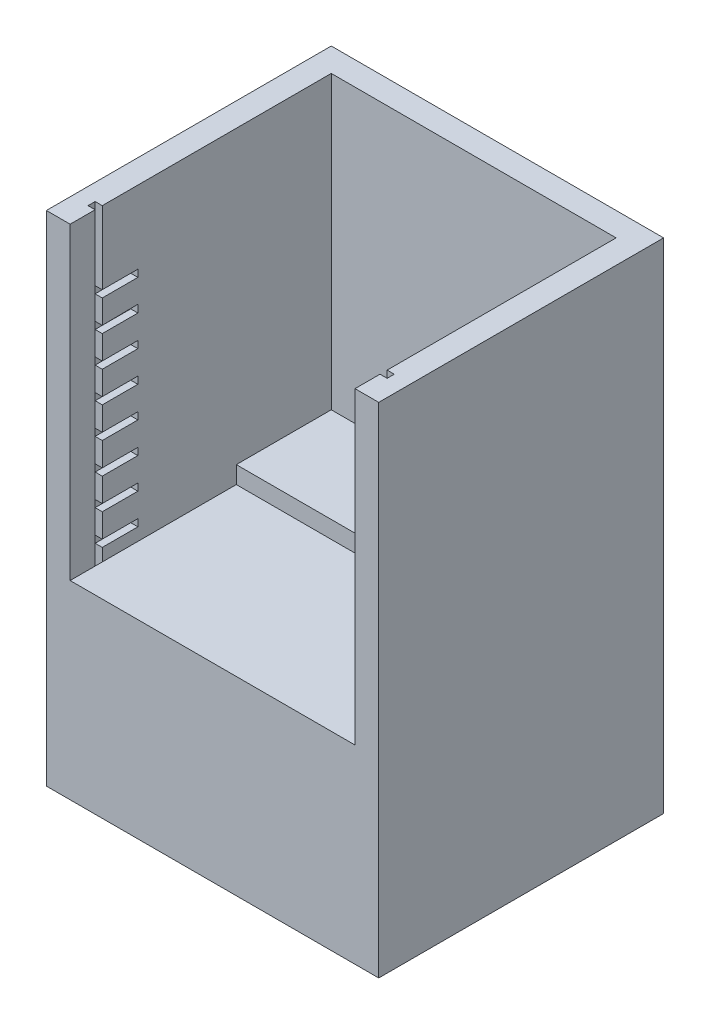
from build123d import *

# Parameters (mm, degrees)
SKETCH1_W           = 140
SKETCH1_H           = 120
BOSS_EXTRUDE1_DEPTH = 10
BOSS_EXTRUDE2_DEPTH = 200
SKETCH3_W           = 15
SKETCH3_H           = 3
CUT_EXTRUDE1_DEPTH  = 3
SKETCH4_W           = 15
SKETCH4_H           = 3
CUT_EXTRUDE2_DEPTH  = 3
SKETCH5_W           = 120
SKETCH5_H           = 7.283967232
BOSS_EXTRUDE3_DEPTH = 40
SKETCH6_W           = 120
SKETCH6_H           = 70
BOSS_EXTRUDE4_DEPTH = 79


with BuildPart() as part:
    # Sketch1 → Boss-Extrude1 (new body)
    with BuildSketch(Plane(origin=(0, 0, 0), x_dir=(1, 0, 0), z_dir=(0, 1, 0))):
        with Locations((70, 60)):
            Rectangle(SKETCH1_W, SKETCH1_H)
    extrude(amount=BOSS_EXTRUDE1_DEPTH)

    # Sketch2 → Boss-Extrude2 (add)
    with BuildSketch(Plane(origin=(0, 10, 0), x_dir=(1, 0, 0), z_dir=(0, 1, 0))):
        Polygon((0, 120), (0, 0), (10, 0), (10, 10.536291888), (7, 10.536291888), (7, 13.536291888), (10, 13.536291888), (10, 110), (70, 110), (70, 120), align=None)
        Polygon((130, 10.536291888), (130, 0), (140, 0), (140, 120), (70, 120), (70, 110), (130, 110), (130, 13.536291888), (133, 13.536291888), (133, 10.536291888), align=None)
    extrude(amount=BOSS_EXTRUDE2_DEPTH)

    # Sketch3 → Cut-Extrude1 (cut)
    with BuildSketch(Plane(origin=(10, 0, 0), x_dir=(0, 0, -1), z_dir=(1, 0, 0))):
        with Locations((21.036291888, 177.819120876)):
            Rectangle(SKETCH3_W, SKETCH3_H)
        Polygon((13.536291888, 166.319120876), (13.536291888, 163.319120876), (28.536291888, 163.319120876), (28.536291888, 166.527780645), align=None)
        with Locations((21.036291888, 151.819120876)):
            Rectangle(SKETCH3_W, SKETCH3_H)
        with Locations((21.036291888, 138.819120876)):
            Rectangle(SKETCH3_W, SKETCH3_H)
        with Locations((21.036291888, 125.819120876)):
            Rectangle(SKETCH3_W, SKETCH3_H)
        with Locations((21.036291888, 112.819120876)):
            Rectangle(SKETCH3_W, SKETCH3_H)
        with Locations((21.036291888, 99.819120876)):
            Rectangle(SKETCH3_W, SKETCH3_H)
        with Locations((21.036291888, 86.819120876)):
            Rectangle(SKETCH3_W, SKETCH3_H)
        Polygon((13.536291888, 75), (13.536291888, 72), (28.533994657, 71.737489743), (28.533994657, 75), align=None)
        with Locations((21.036291888, 60.5)):
            Rectangle(SKETCH3_W, SKETCH3_H)
        Polygon((13.536291888, 49), (13.536291888, 46), (28.536291888, 46), (28.536291888, 49), (13.757115753, 49), align=None)
        with Locations((21.036291888, 34.5)):
            Rectangle(SKETCH3_W, SKETCH3_H)
        with Locations((21.036291888, 21.5)):
            Rectangle(SKETCH3_W, SKETCH3_H)
    extrude(amount=-CUT_EXTRUDE1_DEPTH, mode=Mode.SUBTRACT)

    # Sketch4 → Cut-Extrude2 (cut)
    with BuildSketch(Plane.ZY.offset(-130)):
        with Locations((-21.036291888, 21.5)):
            Rectangle(SKETCH4_W, SKETCH4_H)
        with Locations((-21.036291888, 34.5)):
            Rectangle(SKETCH4_W, SKETCH4_H)
        Polygon((-18.143826221, 46), (-13.536291888, 46), (-13.536291888, 49), (-28.536291888, 49), (-28.536291888, 46), align=None)
        with Locations((-21.036291888, 60.5)):
            Rectangle(SKETCH4_W, SKETCH4_H)
        with Locations((-21.036291888, 73.5)):
            Rectangle(SKETCH4_W, SKETCH4_H)
        with Locations((-21.036291888, 86.5)):
            Rectangle(SKETCH4_W, SKETCH4_H)
        with Locations((-21.036291888, 99.5)):
            Rectangle(SKETCH4_W, SKETCH4_H)
        with Locations((-21.036291888, 112.5)):
            Rectangle(SKETCH4_W, SKETCH4_H)
        with Locations((-21.036291888, 125.5)):
            Rectangle(SKETCH4_W, SKETCH4_H)
        with Locations((-21.036291888, 138.5)):
            Rectangle(SKETCH4_W, SKETCH4_H)
        with Locations((-21.036291888, 151.5)):
            Rectangle(SKETCH4_W, SKETCH4_H)
        with Locations((-21.036291888, 164.5)):
            Rectangle(SKETCH4_W, SKETCH4_H)
        with Locations((-21.036291888, 177.5)):
            Rectangle(SKETCH4_W, SKETCH4_H)
    extrude(amount=-CUT_EXTRUDE2_DEPTH, mode=Mode.SUBTRACT)

    # Sketch5 → Boss-Extrude3 (add)
    with BuildSketch(Plane.XY.offset(-110)):
        with Locations((70, 83.641983616)):
            Rectangle(SKETCH5_W, SKETCH5_H)
    extrude(amount=BOSS_EXTRUDE3_DEPTH)

    # Sketch6 → Boss-Extrude4 (add)
    with BuildSketch(Plane.XY):
        with Locations((70, 45)):
            Rectangle(SKETCH6_W, SKETCH6_H)
    extrude(amount=-BOSS_EXTRUDE4_DEPTH)


solid = part.part
